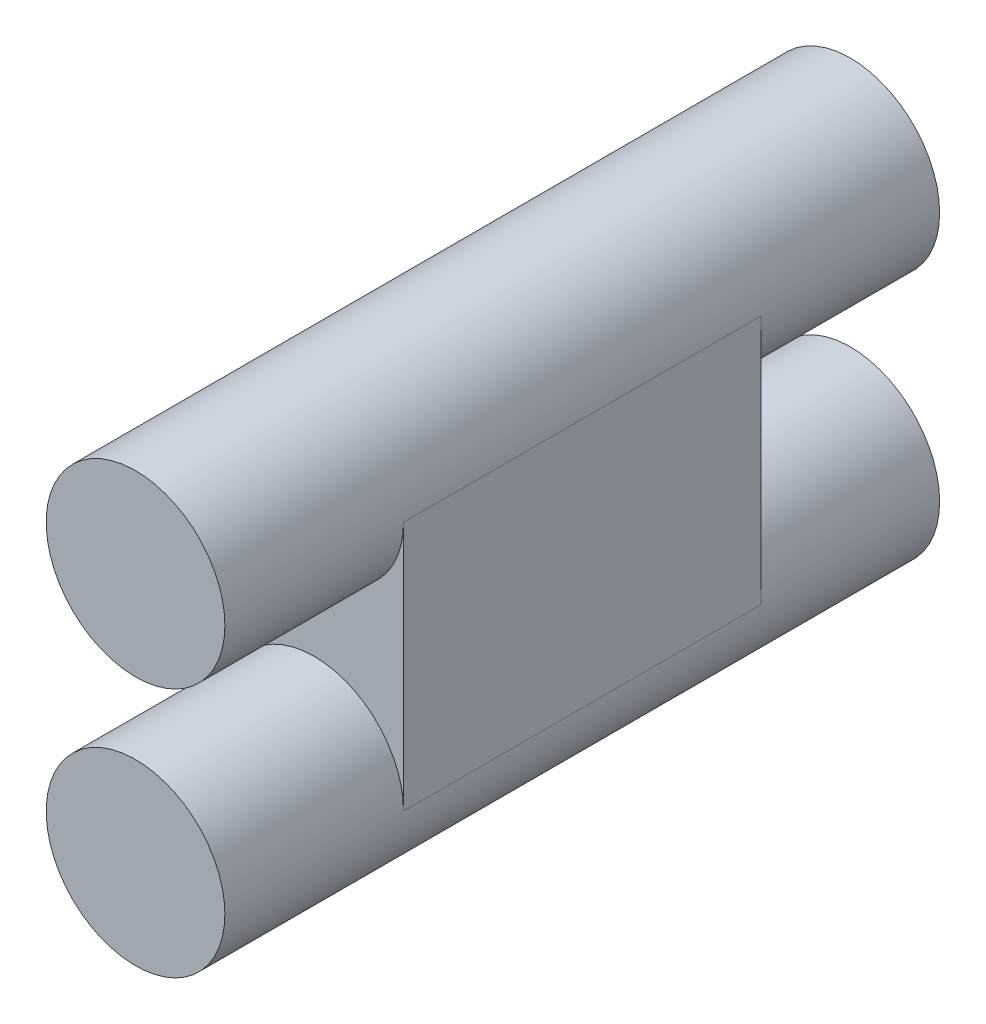
from build123d import *

# Parameters (mm, degrees)
SKETCH1_W           = 10
SKETCH1_H           = 10
BOSS_EXTRUDE1_DEPTH = 14
SKETCH2_R           = 5
BOSS_EXTRUDE2_DEPTH = 20


with BuildPart() as part:
    # Sketch1 → Boss-Extrude1 (new body)
    with BuildSketch(Plane(origin=(0, 0, 0), x_dir=(1, 0, 0), z_dir=(0, 1, 0))):
        with Locations((5, -5)):
            Rectangle(SKETCH1_W, SKETCH1_H)
    boss_extrude1 = extrude(amount=BOSS_EXTRUDE1_DEPTH)

    # Sketch2 → Boss-Extrude2 (add)
    with BuildSketch(Plane.XY):
        with Locations((5, 14)):
            Circle(SKETCH2_R)
        with Locations((5, 0)):
            Circle(SKETCH2_R)
    boss_extrude2 = extrude(amount=BOSS_EXTRUDE2_DEPTH)

    # Mirror1: Boss-Extrude1, Boss-Extrude2 across plane
    add(boss_extrude1.mirror(Plane(origin=(0, 14, 0), x_dir=(1, 0, 0), z_dir=(0, 0, 1))))
    add(boss_extrude2.mirror(Plane(origin=(0, 14, 0), x_dir=(1, 0, 0), z_dir=(0, 0, 1))))


solid = part.part
